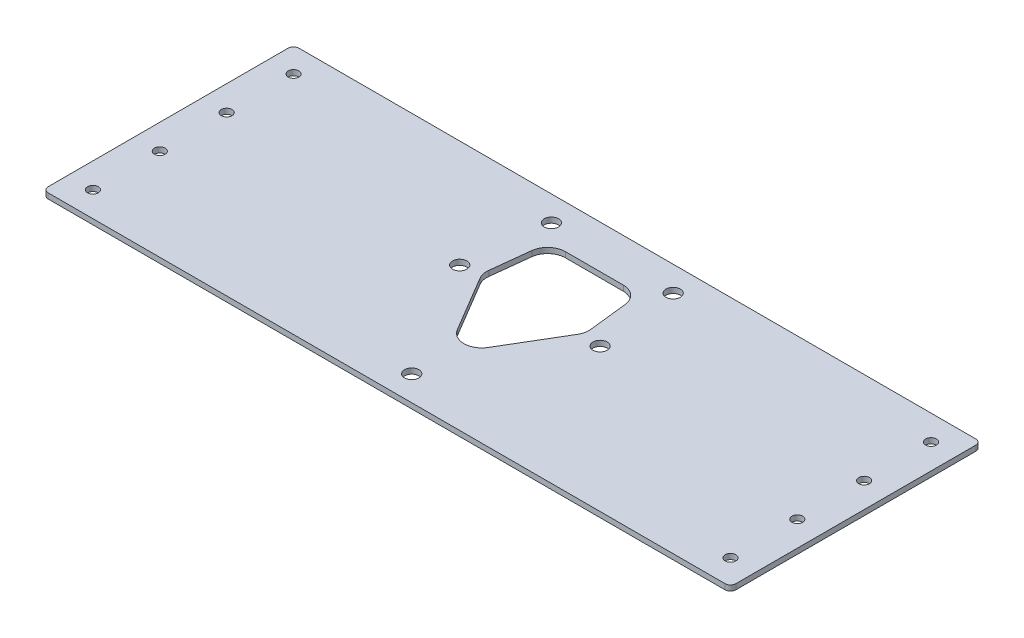
from build123d import *

# Parameters (mm, degrees)
SKETCH1_W           = 384
SKETCH1_H           = 140
SKETCH1_R           = 4
SKETCH1_R_2         = 3
BOSS_EXTRUDE1_DEPTH = 3
FILLET1_R           = 3


with BuildPart() as part:
    # Sketch1 → Boss-Extrude1 (new body)
    with BuildSketch(Plane(origin=(0, 0, 0), x_dir=(1, 0, 0), z_dir=(0, 1, 0))):
        Rectangle(SKETCH1_W, SKETCH1_H)
        with Locations(Location((-34, 56, 0), (0, 0, 270))):
            Circle(SKETCH1_R, mode=Mode.SUBTRACT)
        with Locations(Location((-39.2, 10, 0), (0, 0, 270))):
            Circle(SKETCH1_R, mode=Mode.SUBTRACT)
        with Locations(Location((0, -56, 0), (0, 0, 270))):
            Circle(SKETCH1_R, mode=Mode.SUBTRACT)
        with Locations(Location((39.2, 10, 0), (0, 0, 90))):
            Circle(SKETCH1_R, mode=Mode.SUBTRACT)
        with Locations(Location((34, 56, 0), (0, 0, 90))):
            Circle(SKETCH1_R, mode=Mode.SUBTRACT)
        with Locations(Location((-178, -56, 0), (0, 0, 270))):
            Circle(SKETCH1_R_2, mode=Mode.SUBTRACT)
        with Locations(Location((178, -56, 0), (0, 0, 90))):
            Circle(SKETCH1_R_2, mode=Mode.SUBTRACT)
        with Locations(Location((-178, 56, 0), (0, 0, 90))):
            Circle(SKETCH1_R_2, mode=Mode.SUBTRACT)
        with Locations(Location((178, 56, 0), (0, 0, 270))):
            Circle(SKETCH1_R_2, mode=Mode.SUBTRACT)
        with Locations(Location((-178, 18.666666667, 0), (0, 0, 270))):
            Circle(SKETCH1_R_2, mode=Mode.SUBTRACT)
        with Locations(Location((-178, -18.666666667, 0), (0, 0, 90))):
            Circle(SKETCH1_R_2, mode=Mode.SUBTRACT)
        with Locations(Location((178, 18.666666667, 0), (0, 0, 90))):
            Circle(SKETCH1_R_2, mode=Mode.SUBTRACT)
        with Locations(Location((178, -18.666666667, 0), (0, 0, 270))):
            Circle(SKETCH1_R_2, mode=Mode.SUBTRACT)
        with BuildLine():
            Line((-28.508169209, 15.556618484), (-26.070198724, 37.123280462))
            ThreePointArc((-26.070198724, 37.123280462), (-22.795588541, 43.457640532), (-16.133486944, 46))
            Line((-16.133486944, 46), (16.133486944, 46))
            ThreePointArc((16.133486944, 46), (22.795588541, 43.457640532), (26.070198724, 37.123280462))
            Line((26.070198724, 37.123280462), (28.508169209, 15.556618484))
            ThreePointArc((28.508169209, 15.556618484), (28.348223714, 12.33218572), (27.169289942, 9.326746589))
            Line((27.169289942, 9.326746589), (8.597832514, -21.941523571))
            ThreePointArc((8.597832514, -21.941523571), (0, -26.834932138), (-8.597832514, -21.941523571))
            Line((-8.597832514, -21.941523571), (-27.169289942, 9.326746589))
            ThreePointArc((-27.169289942, 9.326746589), (-28.348223714, 12.33218572), (-28.508169209, 15.556618484))
        make_face(mode=Mode.SUBTRACT)
    extrude(amount=BOSS_EXTRUDE1_DEPTH)

    # Fillet1
    fillet1_edges = [part.edges().sort_by_distance(p)[0] for p in [
        (192, 1.5, 70),
        (-192, 1.5, 70),
        (-192, 1.5, -70),
        (192, 1.5, -70),
    ]]
    fillet(fillet1_edges, radius=FILLET1_R)


solid = part.part
